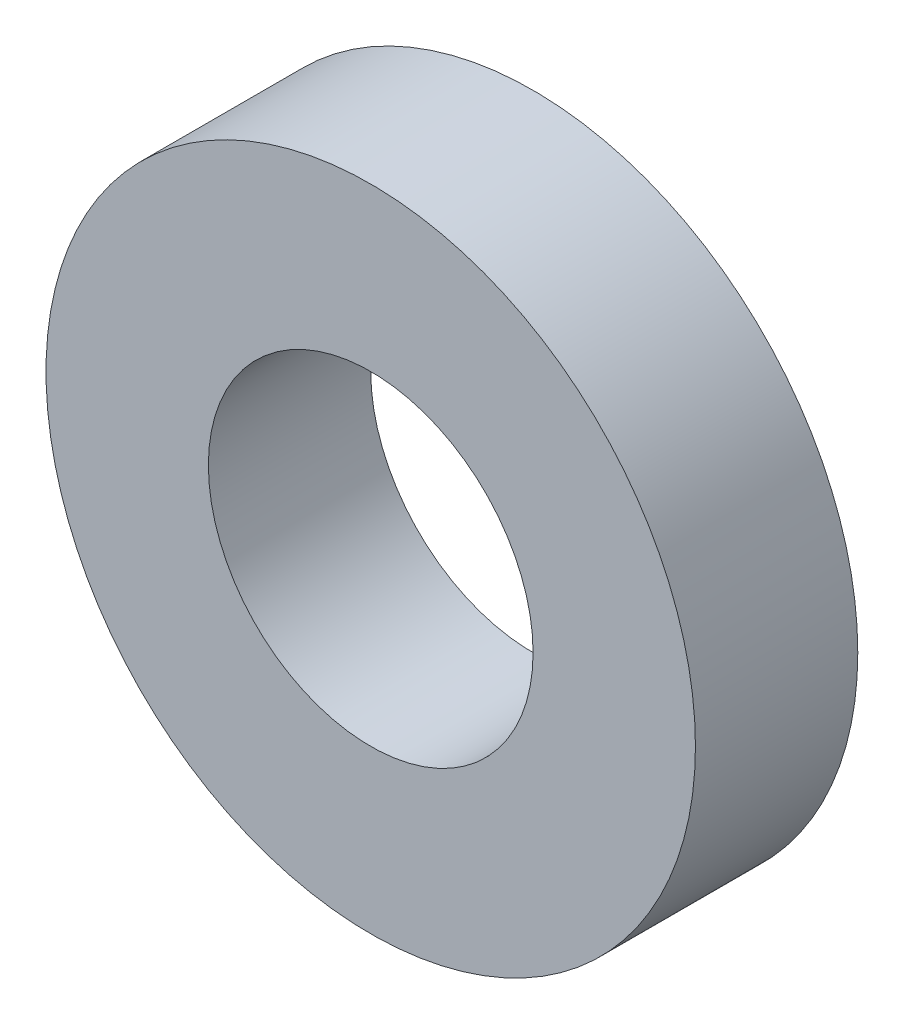
from build123d import *

# Parameters (mm, degrees)
SKETCH1_R           = 10
SKETCH1_R_2         = 5
BOSS_EXTRUDE1_DEPTH = 5


with BuildPart() as part:
    # Sketch1 → Boss-Extrude1 (new body)
    with BuildSketch(Plane.XY):
        Circle(SKETCH1_R)
        Circle(SKETCH1_R_2, mode=Mode.SUBTRACT)
    extrude(amount=BOSS_EXTRUDE1_DEPTH)


solid = part.part
